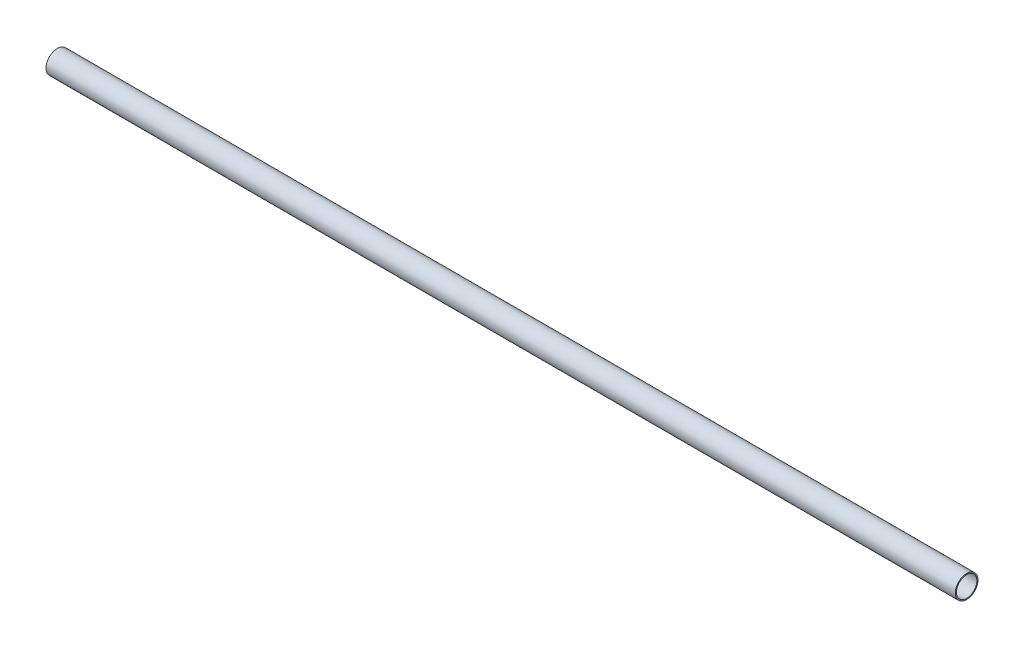
from build123d import *

# Parameters (mm, degrees)
SKETCH_1_R      = 5
SKETCH_1_R_2    = 4.5
EXTRUDE_1_DEPTH = 400


with BuildPart() as part:
    # 草图1 → 凸台-拉伸1 (new body)
    with BuildSketch(Plane(origin=(0, 0, 0), x_dir=(0, 0, -1), z_dir=(1, 0, 0))):
        Circle(SKETCH_1_R)
        Circle(SKETCH_1_R_2, mode=Mode.SUBTRACT)
    extrude(amount=EXTRUDE_1_DEPTH)


solid = part.part
